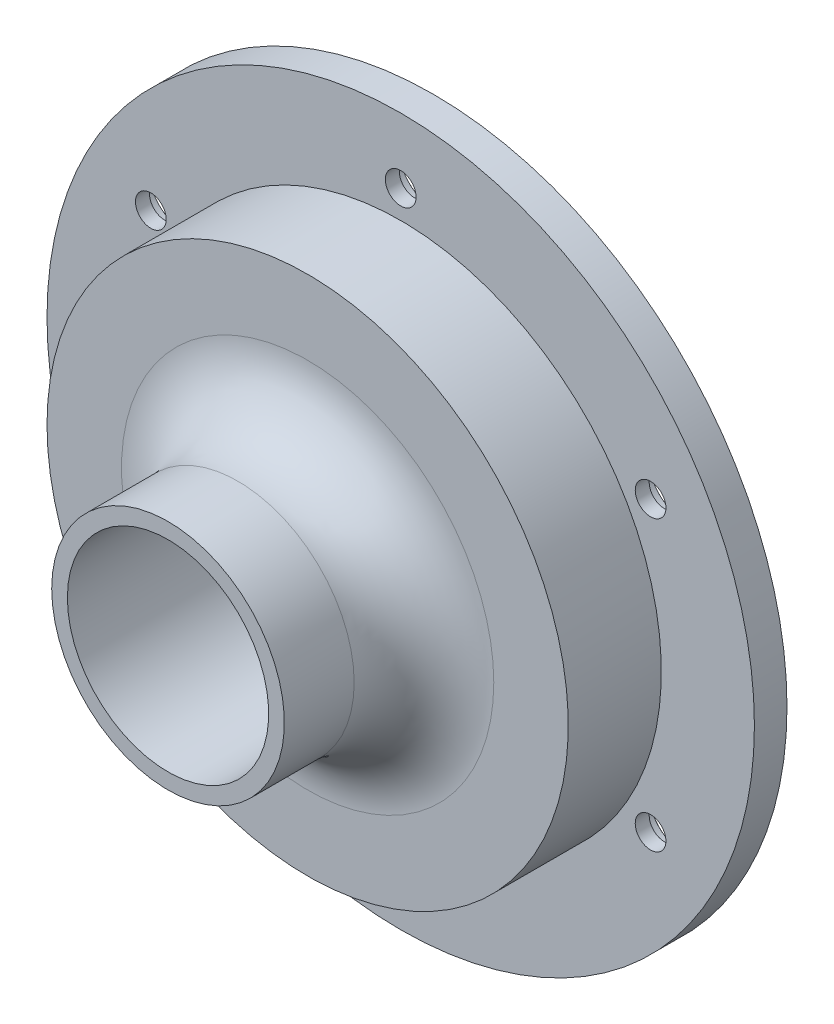
from build123d import *

# Parameters (mm, degrees)
FILLET1_R         = 15
CIRPATTERN1_COUNT = 6


with BuildPart() as part:
    # Sketch1 → Revolve1 (revolve)
    with BuildSketch(Plane(origin=(0, 0, 0), x_dir=(1, 0, 0), z_dir=(0, 1, 0))):
        Polygon((-76.008064516, 0), (-76.008064516, -7), (-56.008064516, -7), (-56.008064516, -27), (-25, -27), (-25, -57), (-21.63, -57), (-21.63, 0), align=None)
    revolve(axis=Axis((0, 0, 0), (0, 0, 1)))

    # Fillet1
    fillet1_edges = [part.edges().sort_by_distance(p)[0] for p in [
        (25, 0, 27),
    ]]
    fillet(fillet1_edges, radius=FILLET1_R)

    # Sketch3 → CBORE for M6 Hex Head Bolt1 (revolve, cut)
    with BuildSketch(Plane(origin=(0, 62, 0), x_dir=(0, 1, 0), z_dir=(1, 0, 0))):
        Polygon((0, 0), (0, 57), (3.3, 57), (3.3, 4), (7.2735, 4), (7.2735, 0.025), (7.2985, 0), align=None)
    cbore_for_m6_hex_head_bolt1 = revolve(axis=Axis((0, 62, -6.35), (0, 0, 1)), mode=Mode.SUBTRACT)

    # CirPattern1: CBORE for M6 Hex Head Bolt1 ×6 about axis
    cirpattern1_axis = Axis((0, 0, 0), (0, 0, 1))
    for i in range(1, CIRPATTERN1_COUNT):
        add(cbore_for_m6_hex_head_bolt1.rotate(cirpattern1_axis, i * 360 / CIRPATTERN1_COUNT), mode=Mode.SUBTRACT)


solid = part.part
